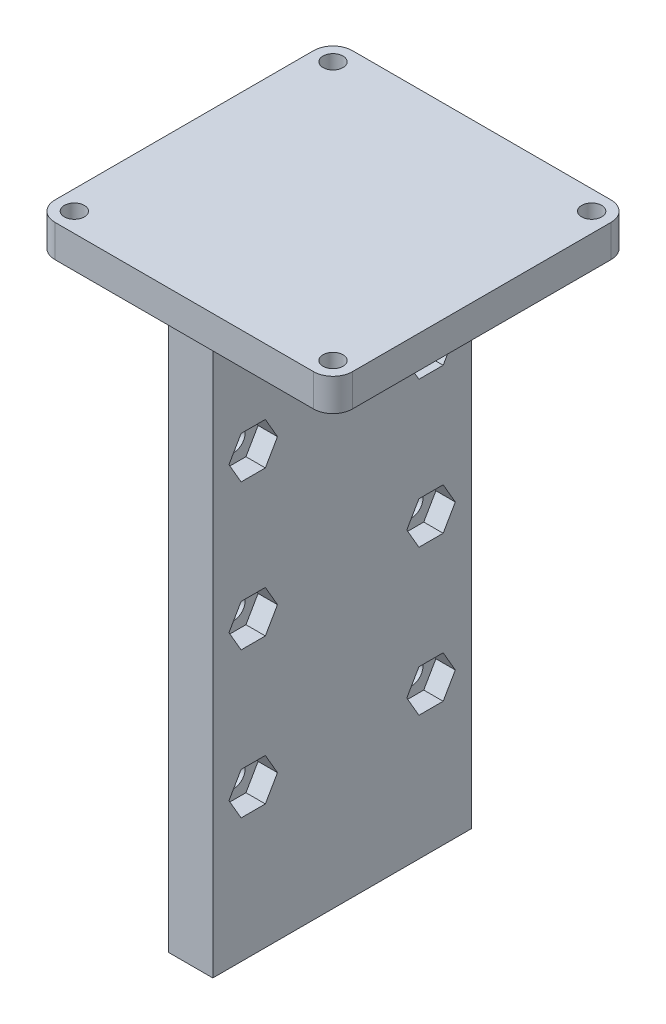
from build123d import *

# Parameters (mm, degrees)
SLEEVE_OUTLINE_DEPTH = 46
SKETCH2_4_W          = 6.825
SKETCH2_4_H          = 90
BEAM_MOUNTING_DEPTH  = 40
SKETCH3_R            = 1.75
NUT_INSERTS_DEPTH    = 3
SKETCH3_4_R          = 1.75
SCREW_INSERTS_DEPTH  = 23
SKETCH4_R            = 1.55
BOARD_SHAPING_DEPTH  = 10


with BuildPart() as part:
    # Sketch2 → Sleeve_Outline (new body)
    with BuildSketch(Plane.XY):
        Polygon((-14.5875, 90), (0, 90), (6.825, 90), (10, 90), (10.005, 90), (13.005, 90), (31.4125, 90), (31.4125, 95), (-14.5875, 95), align=None)
    extrude(amount=SLEEVE_OUTLINE_DEPTH)

    # Sketch2<4> → Beam_Mounting (add)
    with BuildSketch(Plane.XY):
        with Locations((3.4125, 45)):
            Rectangle(SKETCH2_4_W, SKETCH2_4_H)
        Polygon((10.005, 90), (13.005, 90), (10.005, 87), align=None)
    extrude(amount=BEAM_MOUNTING_DEPTH)

    # Sketch3 → Nut_Inserts (cut)
    # profile 1 of 6: a face of its own
    with BuildSketch(Plane(origin=(6.825, 0, 0), x_dir=(0, 0, -1), z_dir=(1, 0, 0))):
        Polygon((-30, 45), (-31.875, 48.247595264), (-35.625, 48.247595264), (-37.5, 45), (-35.625, 41.752404736), (-31.875, 41.752404736), align=None)
        with Locations((-33.75, 45)):
            Circle(SKETCH3_R, mode=Mode.SUBTRACT)
    # profile 2 of 6: a face of its own
    with BuildSketch(Plane(origin=(6.825, 0, 0), x_dir=(0, 0, -1), z_dir=(1, 0, 0))):
        Polygon((-37.5, 22.5), (-35.625, 19.252404736), (-31.875, 19.252404736), (-30, 22.5), (-31.875, 25.747595264), (-35.625, 25.747595264), align=None)
        with Locations((-33.75, 22.5)):
            Circle(SKETCH3_R, mode=Mode.SUBTRACT)
    # profile 3 of 6: a face of its own
    with BuildSketch(Plane(origin=(6.825, 0, 0), x_dir=(0, 0, -1), z_dir=(1, 0, 0))):
        Polygon((-37.5, 67.5), (-35.625, 64.252404736), (-31.875, 64.252404736), (-30, 67.5), (-31.875, 70.747595264), (-35.625, 70.747595264), align=None)
        with Locations((-33.75, 67.5)):
            Circle(SKETCH3_R, mode=Mode.SUBTRACT)
    # profile 4 of 6: a face of its own
    with BuildSketch(Plane(origin=(6.825, 0, 0), x_dir=(0, 0, -1), z_dir=(1, 0, 0))):
        Polygon((-8.125, 70.747595264), (-4.375, 70.747595264), (-2.5, 67.5), (-4.375, 64.252404736), (-8.125, 64.252404736), (-10, 67.5), align=None)
        with Locations((-6.25, 67.5)):
            Circle(SKETCH3_R, mode=Mode.SUBTRACT)
    # profile 5 of 6: a face of its own
    with BuildSketch(Plane(origin=(6.825, 0, 0), x_dir=(0, 0, -1), z_dir=(1, 0, 0))):
        Polygon((-4.375, 48.247595264), (-2.5, 45), (-4.375, 41.752404736), (-8.125, 41.752404736), (-10, 45), (-8.125, 48.247595264), align=None)
        with Locations((-6.25, 45)):
            Circle(SKETCH3_R, mode=Mode.SUBTRACT)
    # profile 6 of 6: a face of its own
    with BuildSketch(Plane(origin=(6.825, 0, 0), x_dir=(0, 0, -1), z_dir=(1, 0, 0))):
        Polygon((-4.375, 25.747595264), (-2.5, 22.5), (-4.375, 19.252404736), (-8.125, 19.252404736), (-10, 22.5), (-8.125, 25.747595264), align=None)
        with Locations((-6.25, 22.5)):
            Circle(SKETCH3_R, mode=Mode.SUBTRACT)
    extrude(amount=-NUT_INSERTS_DEPTH, mode=Mode.SUBTRACT)

    # Sketch3<4> → Screw_Inserts (cut)
    with BuildSketch(Plane(origin=(6.825, 0, 0), x_dir=(0, 0, -1), z_dir=(1, 0, 0))):
        with Locations((-33.75, 67.5)):
            Circle(SKETCH3_4_R)
        with Locations((-33.75, 45)):
            Circle(SKETCH3_4_R)
        with Locations((-33.75, 22.5)):
            Circle(SKETCH3_4_R)
        with Locations((-6.25, 22.5)):
            Circle(SKETCH3_4_R)
        with Locations((-6.25, 45)):
            Circle(SKETCH3_4_R)
        with Locations((-6.25, 67.5)):
            Circle(SKETCH3_4_R)
    extrude(amount=-SCREW_INSERTS_DEPTH, mode=Mode.SUBTRACT)

    # Sketch4 → Board_Shaping (cut)
    with BuildSketch(Plane(origin=(0, 95, 0), x_dir=(1, 0, 0), z_dir=(0, 1, 0))):
        with BuildLine():
            ThreePointArc((-11.5875, -46), (-13.708820344, -45.121320344), (-14.5875, -43))
            Line((-14.5875, -43), (-14.5875, -46))
            Line((-14.5875, -46), (-11.5875, -46))
        make_face()
        with Locations(Location((-11.5875, -43, 0), (0, 0, 270))):
            Circle(SKETCH4_R)
        with Locations(Location((-11.5875, -3, 0), (0, 0, 270))):
            Circle(SKETCH4_R)
        with BuildLine():
            ThreePointArc((-14.5875, -3), (-13.708820344, -0.878679656), (-11.5875, 0))
            Line((-11.5875, 0), (-14.5875, 0))
            Line((-14.5875, 0), (-14.5875, -3))
        make_face()
        with BuildLine():
            Line((31.4125, 0), (28.4125, 0))
            ThreePointArc((28.4125, 0), (30.533820344, -0.878679656), (31.4125, -3))
            Line((31.4125, -3), (31.4125, 0))
        make_face()
        with Locations(Location((28.4125, -3, 0), (0, 0, 270))):
            Circle(SKETCH4_R)
        with Locations(Location((28.4125, -43, 0), (0, 0, 270))):
            Circle(SKETCH4_R)
        with BuildLine():
            Line((31.4125, -46), (31.4125, -43))
            ThreePointArc((31.4125, -43), (30.533820344, -45.121320344), (28.4125, -46))
            Line((28.4125, -46), (31.4125, -46))
        make_face()
    extrude(amount=-BOARD_SHAPING_DEPTH, mode=Mode.SUBTRACT)


solid = part.part
